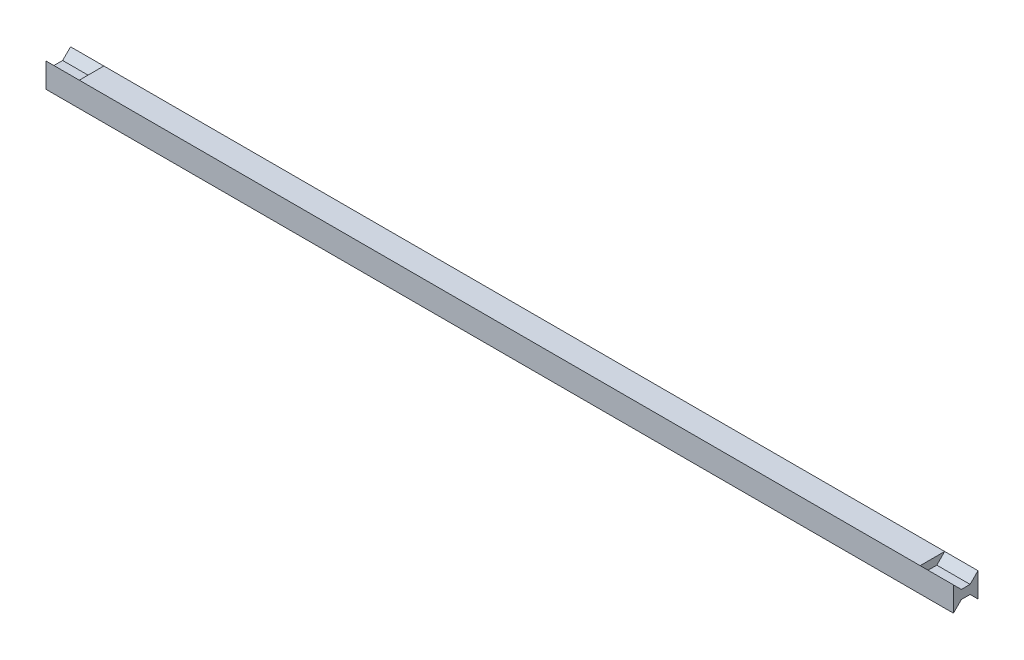
from build123d import *

# Parameters (mm, degrees)
SKICA1_W                = 202
SKICA1_H                = 5.9
P_IDAT_VYSUNUT_M1_DEPTH = 5.9
P_IDAT_VYSUNUT_M2_DEPTH = 8
P_IDAT_VYSUNUT_M3_DEPTH = 8


with BuildPart() as part:
    # Skica1 → Přidat vysunutím1 (new body)
    with BuildSketch(Plane(origin=(0, 0, 0), x_dir=(1, 0, 0), z_dir=(0, 1, 0))):
        with Locations((101, 2.95)):
            Rectangle(SKICA1_W, SKICA1_H)
    extrude(amount=P_IDAT_VYSUNUT_M1_DEPTH)

    # Skica2 → Přidat vysunutím2 (add)
    with BuildSketch(Plane.ZY):
        Polygon((-5.9, 5.9), (-5.9, 0), (-4, 1.9), (-1.9, 1.9), (0, 0), (0, 5.9), (-1.9, 4), (-4, 4), align=None)
    extrude(amount=P_IDAT_VYSUNUT_M2_DEPTH)

    # Skica3 → Přidat vysunutím3 (add)
    with BuildSketch(Plane(origin=(202, 0, 0), x_dir=(0, 0, -1), z_dir=(1, 0, 0))):
        Polygon((0, 5.9), (0, 0), (1.9, 1.9), (4, 1.9), (5.9, 0), (5.9, 5.9), (4, 4), (1.9, 4), align=None)
    extrude(amount=P_IDAT_VYSUNUT_M3_DEPTH)


solid = part.part
